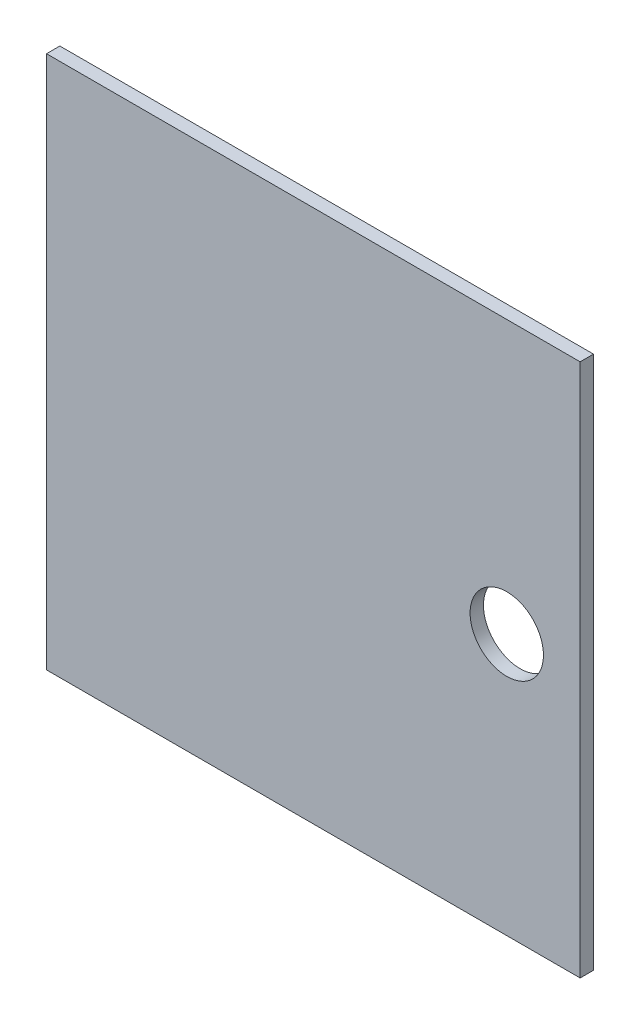
from build123d import *

# Parameters (mm, degrees)
SKETCH1_W           = 100
SKETCH1_H           = 100
BOSS_EXTRUDE1_DEPTH = 2.5
SKETCH4_R           = 6.875
CUT_EXTRUDE1_DEPTH  = 142.443451598


with BuildPart() as part:
    # Sketch1 → Boss-Extrude1 (new body)
    with BuildSketch(Plane.XY):
        with Locations((50, 50)):
            Rectangle(SKETCH1_W, SKETCH1_H)
    extrude(amount=BOSS_EXTRUDE1_DEPTH)

    # Sketch4 → Cut-Extrude1 (cut, through all)
    with BuildSketch(Plane.XY.offset(2.5)):
        with Locations((86.250042234, 48.943031999)):
            Circle(SKETCH4_R)
    extrude(amount=-CUT_EXTRUDE1_DEPTH, mode=Mode.SUBTRACT)


solid = part.part
